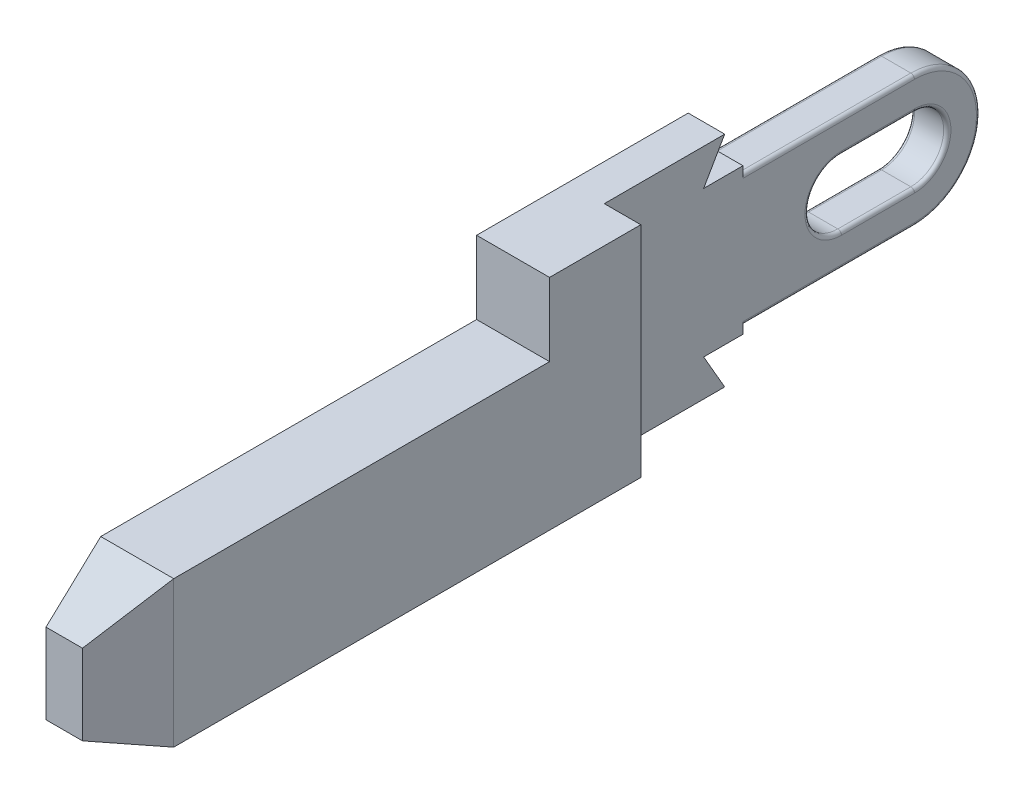
from build123d import *

# Parameters (mm, degrees)
EXTRUDE_1_DEPTH     = 2
SKETCH_2_W          = 12.040955426
SKETCH_2_H          = 8.971692278
CUT_EXTRUDE_1_DEPTH = 1
CHAMFER_1_SIZE      = 0.5
CHAMFER_1_SIZE2     = 2
CHAMFER_2_SIZE      = 2
CHAMFER_2_SIZE2     = 0.5
FILLET_1_R          = 0.1


with BuildPart() as part:
    # Эскиз1 → Бобышка-Вытянуть1 (new body)
    with BuildSketch(Plane(origin=(0, 0, 0), x_dir=(0, 0, -1), z_dir=(1, 0, 0))):
        with BuildLine():
            Line((0, 0), (0, 1.1))
            Line((0, 1.1), (2, 2))
            Line((2, 2), (12.3, 2))
            Line((12.3, 2), (12.3, 4))
            Line((12.3, 4), (18.1, 4))
            Line((18.1, 4), (17.522649731, 3))
            Line((17.522649731, 3), (18.6, 3))
            Line((18.6, 3), (18.6, 2.8))
            Line((18.6, 2.8), (23.3, 2.8))
            ThreePointArc((23.3, 2.8), (25.1, 1), (23.3, -0.8))
            Line((23.3, -0.8), (18.6, -0.8))
            Line((18.6, -0.8), (18.6, -1))
            Line((18.6, -1), (17.522649731, -1))
            Line((17.522649731, -1), (18.1, -2))
            Line((18.1, -2), (2, -2))
            Line((2, -2), (0, -1.1))
            Line((0, -1.1), (0, 0))
        make_face()
        with BuildLine():
            Line((21.3, 1.9), (23.3, 1.9))
            ThreePointArc((23.3, 1.9), (24.2, 1), (23.3, 0.1))
            Line((23.3, 0.1), (21.3, 0.1))
            ThreePointArc((21.3, 0.1), (20.4, 1), (21.3, 1.9))
        make_face(mode=Mode.SUBTRACT)
    extrude(amount=EXTRUDE_1_DEPTH)

    # Эскиз2 → Вырез-Вытянуть1 (cut)
    with BuildSketch(Plane(origin=(2, 0, 0), x_dir=(0, 0, -1), z_dir=(1, 0, 0))):
        with Locations((20.820477713, 1.144281601)):
            Rectangle(SKETCH_2_W, SKETCH_2_H)
    extrude(amount=-CUT_EXTRUDE_1_DEPTH, mode=Mode.SUBTRACT)

    # Фаска1
    chamfer_1_edges = [part.edges().sort_by_distance(p)[0] for p in [
        (2, 0, 0),
    ]]
    chamfer_1_side = [part.faces().sort_by_distance(p)[0] for p in [
        (1, 0, 0),
    ]]
    chamfer(chamfer_1_edges, length=CHAMFER_1_SIZE, length2=CHAMFER_1_SIZE2, reference=chamfer_1_side[0])

    # Фаска2
    chamfer_2_edges = [part.edges().sort_by_distance(p)[0] for p in [
        (0, 0, 0),
    ]]
    chamfer_2_side = [part.faces().sort_by_distance(p)[0] for p in [
        (0, 0.523557469, -12.027852409),
    ]]
    chamfer(chamfer_2_edges, length=CHAMFER_2_SIZE, length2=CHAMFER_2_SIZE2, reference=chamfer_2_side[0])

    # Скругление1
    fillet_1_edges = [part.edges().sort_by_distance(p)[0] for p in [
        (0, 2.8, -20.95),
        (0, 1, -25.1),
        (0, -0.8, -20.95),
        (0, 1, -20.4),
        (0, 0.1, -22.3),
        (0, 1, -24.2),
        (0, 1.9, -22.3),
        (1, 1.9, -22.3),
        (1, 1, -20.4),
        (1, 0.1, -22.3),
        (1, 1, -24.2),
        (1, -0.8, -20.95),
        (1, 1, -25.1),
        (1, 2.8, -20.95),
    ]]
    fillet(fillet_1_edges, radius=FILLET_1_R)


solid = part.part
